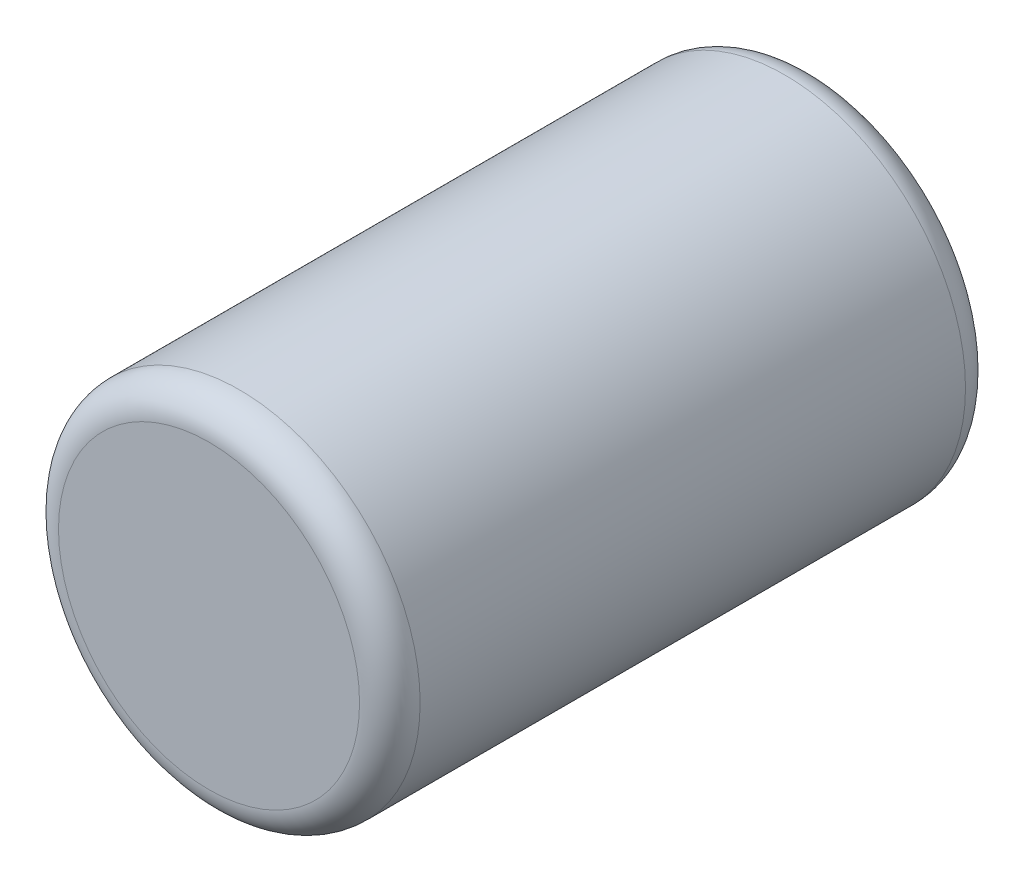
from build123d import *

# Parameters (mm, degrees)
SKETCH1_R           = 37.8968
BOSS_EXTRUDE1_DEPTH = 127
FILLET1_R           = 6.35


with BuildPart() as part:
    # Sketch1 → Boss-Extrude1 (new body)
    with BuildSketch(Plane.XY):
        Circle(SKETCH1_R)
    extrude(amount=BOSS_EXTRUDE1_DEPTH)

    # Fillet1
    fillet1_edges = [part.edges().sort_by_distance(p)[0] for p in [
        (-37.8968, 0, 0),
        (-37.8968, 0, 127),
    ]]
    fillet(fillet1_edges, radius=FILLET1_R)


solid = part.part
